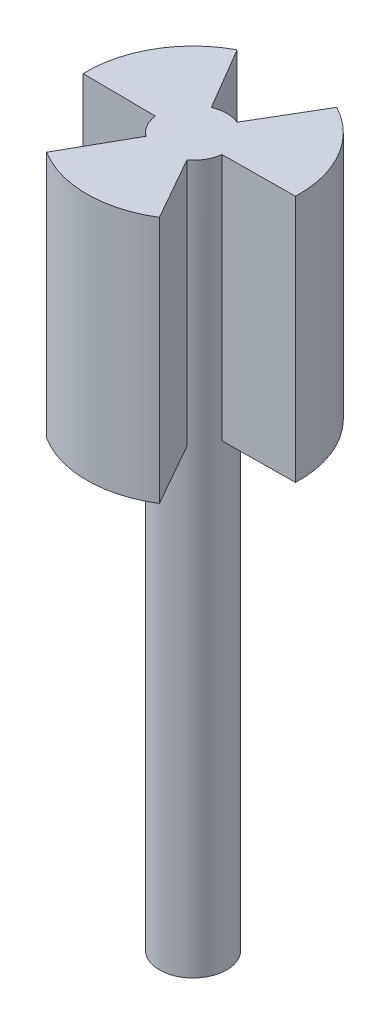
from build123d import *
from build123d.topology import SkipClean

# Parameters (mm, degrees)
SKETCH1_R           = 9.5
BOSS_EXTRUDE1_DEPTH = 200
BOSS_EXTRUDE2_START = -70
SKETCH2_R           = 30
SKETCH2_R_2         = 9.5
BOSS_EXTRUDE2_DEPTH = 70
CUT_EXTRUDE1_DEPTH  = 137.747943312
CIRPATTERN1_COUNT   = 3


with BuildPart() as part:
    # Sketch1 → Boss-Extrude1 (new body)
    with BuildSketch(Plane(origin=(0, 0, 0), x_dir=(1, 0, 0), z_dir=(0, 1, 0))):
        with Locations(Location((0, 0, 0), (0, 0, 270))):
            Circle(SKETCH1_R)
    extrude(amount=BOSS_EXTRUDE1_DEPTH)

    # Sketch2 → Boss-Extrude2 (add)
    with BuildSketch(Plane(origin=(0, 200, 0), x_dir=(1, 0, 0), z_dir=(0, 1, 0)).offset(BOSS_EXTRUDE2_START)):
        with Locations(Location((0, 0, 0), (0, 0, 270))):
            Circle(SKETCH2_R)
        with Locations(Location((0, 0, 0), (0, 0, 270))):
            Circle(SKETCH2_R_2, mode=Mode.SUBTRACT)
    extrude(amount=BOSS_EXTRUDE2_DEPTH)

    # Sketch3 → Cut-Extrude1 (cut, through all)
    with SkipClean():  # the faces are left unmerged after this step: merging them gives an invalid solid
        with BuildSketch(Plane.XZ.offset(-130)):
            with BuildLine():
                Line((20.805356407, -37.93850618), (-20.805356407, -37.93850618))
                Line((-20.805356407, -37.93850618), (-3.621476876, -8.782647963))
                ThreePointArc((-3.621476876, -8.782647963), (0, -9.5), (3.621476876, -8.782647963))
                Line((3.621476876, -8.782647963), (20.805356407, -37.93850618))
            make_face()
        cut_extrude1 = extrude(amount=-CUT_EXTRUDE1_DEPTH, mode=Mode.SUBTRACT)

    # CirPattern1: Cut-Extrude1 ×3 about axis
    with SkipClean():  # the faces are left unmerged after this step: merging them gives an invalid solid
        cirpattern1_axis = Axis((0, 0, 0), (0, 1, 0))
        for i in range(1, CIRPATTERN1_COUNT):
            add(cut_extrude1.rotate(cirpattern1_axis, i * 360 / CIRPATTERN1_COUNT), mode=Mode.SUBTRACT)


solid = part.part
